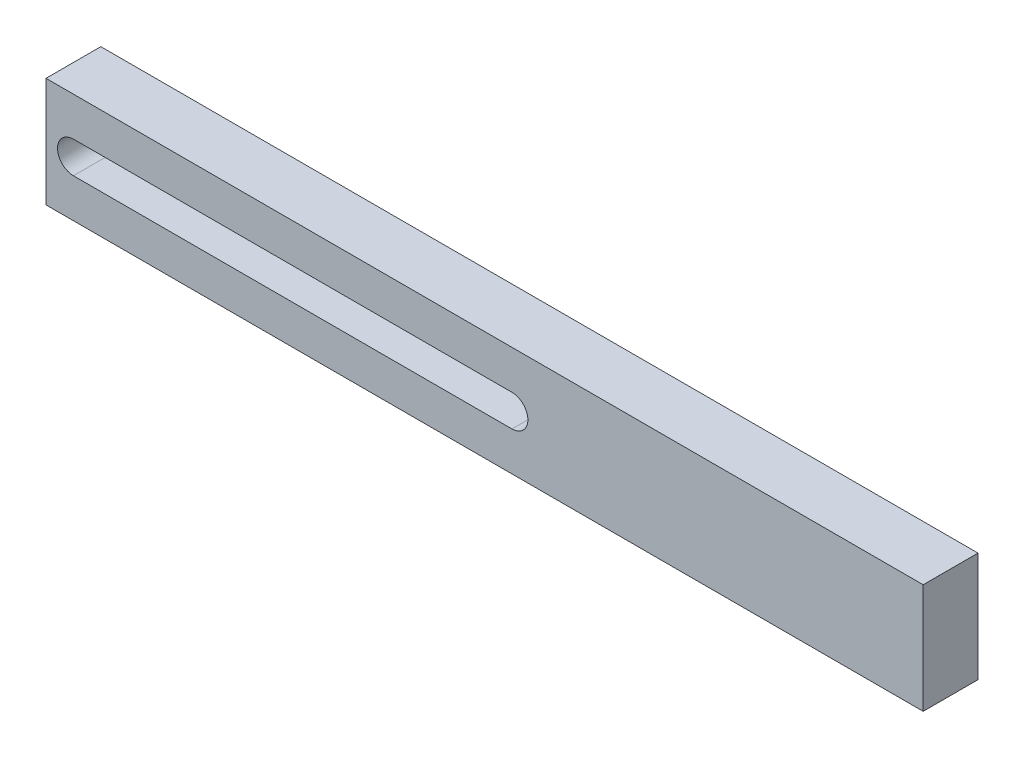
from build123d import *

# Parameters (mm, degrees)
SKETCH1_W               = 203.2
SKETCH1_H               = 25.4
BOSS_EXTRUDE1_DEPTH     = 6.35
CUT_EXTRUDE1_DEPTH      = 104.175287739
CUT_EXTRUDE1_DEPTH_BACK = 104.175287739


with BuildPart() as part:
    # Sketch1 → Boss-Extrude1 (new, symmetric)
    with BuildSketch(Plane.XY):
        Rectangle(SKETCH1_W, SKETCH1_H)
    extrude(amount=BOSS_EXTRUDE1_DEPTH, both=True)

    # Sketch2 → Cut-Extrude1 (cut, two sides: drawn at the far end of the back side and taken through both)
    with BuildSketch(Plane.XY.offset(6.35).offset(-CUT_EXTRUDE1_DEPTH_BACK)):
        with BuildLine():
            Line((-95.25, 3.675), (6.35, 3.675))
            ThreePointArc((6.35, 3.675), (10.025, 0), (6.35, -3.675))
            Line((6.35, -3.675), (-95.25, -3.675))
            ThreePointArc((-95.25, -3.675), (-98.925, 0), (-95.25, 3.675))
        make_face()
    extrude(amount=CUT_EXTRUDE1_DEPTH + CUT_EXTRUDE1_DEPTH_BACK, mode=Mode.SUBTRACT)


solid = part.part
